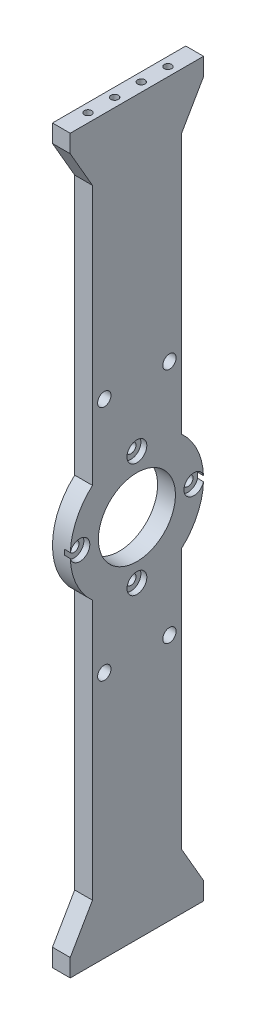
from build123d import *

# Parameters (mm, degrees)
SKETCH_1_W                  = 6
SKETCH_1_H                  = 30
EXTRUDE_1_DEPTH             = 247
SKETCH_2_R                  = 22.5
EXTRUDE_2_DEPTH             = 6
SKETCH_3_R                  = 13
CUT_EXTRUDE_1_DEPTH         = 250.90248098
HOLE_WIZARD_M31_D           = 3.4
HOLE_WIZARD_M31_CBORE_D     = 6.7
HOLE_WIZARD_M31_CBORE_DEPTH = 2
HOLE_WIZARD_M41_D           = 4.5
EXTRUDE_3_DEPTH             = 6
M3X0_51_D                   = 2.5
M3X0_51_DEPTH               = 8.5
M3X0_51_TIP                 = 0.751075774
M3X0_52_D                   = 2.5
M3X0_52_DEPTH               = 8.5
M3X0_52_TIP                 = 0.751075774


with BuildPart() as part:
    # Эскиз1 → Бобышка-Вытянуть1 (new body)
    with BuildSketch(Plane(origin=(0, 0, 0), x_dir=(1, 0, 0), z_dir=(0, 1, 0))):
        with Locations((3, -15)):
            Rectangle(SKETCH_1_W, SKETCH_1_H)
    extrude(amount=EXTRUDE_1_DEPTH)

    # Эскиз2 → Бобышка-Вытянуть2 (add)
    with BuildSketch(Plane.ZY):
        with Locations((15, 123.5)):
            Circle(SKETCH_2_R)
    extrude(amount=-EXTRUDE_2_DEPTH)

    # Эскиз3 → Вырез-Вытянуть1 (cut, through all)
    with BuildSketch(Plane.ZY):
        with Locations((15, 123.5)):
            Circle(SKETCH_3_R)
    extrude(amount=-CUT_EXTRUDE_1_DEPTH, mode=Mode.SUBTRACT)

    # Цековка для  винта с полукруглой головкой M31 (through all)
    with Locations(Plane(origin=(6, -25.024735225, 7.262908886), x_dir=(0, 0, 1), z_dir=(1, 0, 0))):
        with Locations((7.737091114, -167.774735225), (-11.512908886, -148.524735225), (7.737091114, -129.274735225), (26.987091114, -148.524735225)):
            CounterBoreHole(HOLE_WIZARD_M31_D / 2, HOLE_WIZARD_M31_CBORE_D / 2, HOLE_WIZARD_M31_CBORE_DEPTH)

    # Отверстие с зазором M41 (through all)
    with Locations(Plane(origin=(6, 0, 0), x_dir=(0, 0, -1), z_dir=(1, 0, 0))):
        with Locations((-26, 163.5), (-4, 163.5), (-4, 83.5), (-26, 83.5)):
            Hole(HOLE_WIZARD_M41_D / 2)

    # Эскиз11 → Бобышка-Вытянуть3 (add)
    with BuildSketch(Plane(origin=(6, 0, 0), x_dir=(0, 0, -1), z_dir=(1, 0, 0))):
        Polygon((-37.5, 241), (-30, 228.009618943), (0, 228.009618943), (7.5, 241), (7.5, 247), (-37.5, 247), align=None)
        Polygon((0, 18.990381057), (7.5, 6), (7.5, 0), (-37.5, 0), (-37.5, 6), (-30, 18.990381057), align=None)
    extrude(amount=-EXTRUDE_3_DEPTH)

    # Отверстие обработанное метчиком M3x0.51
    with Locations(Plane(origin=(0, 0, 0), x_dir=(-1, 0, 0), z_dir=(0, -1, 0))):
        with Locations((-3, -28.5), (-3, -19.5), (-3, -10.5), (-3, -1.5)):
            Hole(M3X0_51_D / 2, depth=M3X0_51_DEPTH)
            with Locations((0, 0, -(M3X0_51_DEPTH + M3X0_51_TIP / 2))):  # 118° drill point
                Cone(0, M3X0_51_D / 2, M3X0_51_TIP, mode=Mode.SUBTRACT)

    # Отверстие обработанное метчиком M3x0.52
    with Locations(Plane(origin=(0, 247, 0), x_dir=(1, 0, 0), z_dir=(0, 1, 0))):
        with Locations((3, -1.5), (3, -10.5), (3, -19.5), (3, -28.5)):
            Hole(M3X0_52_D / 2, depth=M3X0_52_DEPTH)
            with Locations((0, 0, -(M3X0_52_DEPTH + M3X0_52_TIP / 2))):  # 118° drill point
                Cone(0, M3X0_52_D / 2, M3X0_52_TIP, mode=Mode.SUBTRACT)


solid = part.part
